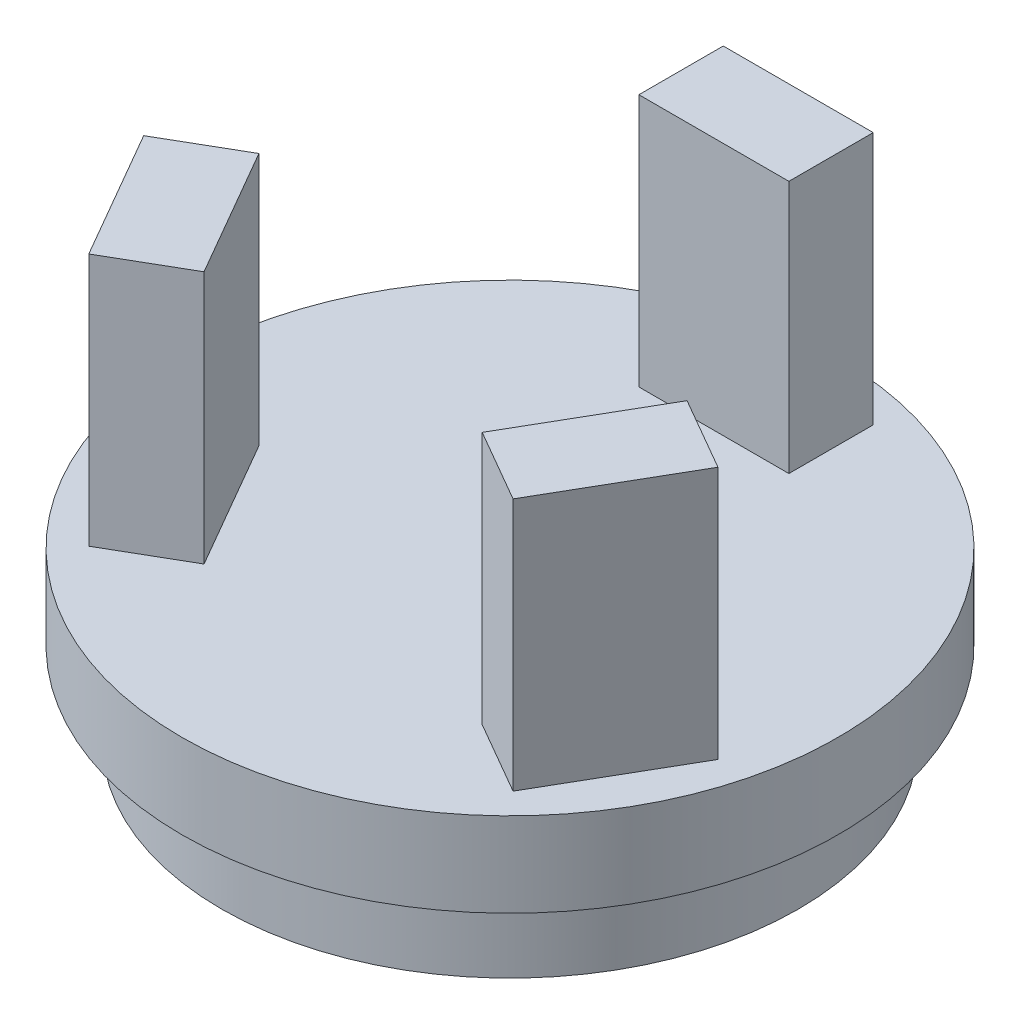
from build123d import *

# Parameters (mm, degrees)
ESQUISSE2_R        = 61.5
BOSS_EXTRU_1_DEPTH = 18
ESQUISSE3_R        = 70
BOSS_EXTRU_2_DEPTH = 18
BOSS_EXTRU_3_DEPTH = 54


with BuildPart() as part:
    # Esquisse2 → Boss.-Extru.1 (new body)
    with BuildSketch(Plane(origin=(0, 0, 0), x_dir=(1, 0, 0), z_dir=(0, 1, 0))):
        with Locations(Location((50.887518325, 23.784383565, 0), (0, 0, 270))):
            Circle(ESQUISSE2_R)
    extrude(amount=BOSS_EXTRU_1_DEPTH)

    # Esquisse3 → Boss.-Extru.2 (add)
    with BuildSketch(Plane(origin=(0, 18, 0), x_dir=(1, 0, 0), z_dir=(0, 1, 0))):
        with Locations(Location((50.887518325, 23.784383565, 0), (0, 0, 270))):
            Circle(ESQUISSE3_R)
    extrude(amount=BOSS_EXTRU_2_DEPTH)

    # Esquisse4 → Boss.-Extru.3 (add)
    with BuildSketch(Plane(origin=(0, 36, 0), x_dir=(1, 0, 0), z_dir=(0, 1, 0))):
        with BuildLine():
            ThreePointArc((-2.373044008, -6.965616435), (2.122342369, -13.688374727), (7.460993068, -19.763141096))
            Line((7.460993068, -19.763141096), (21.215413261, -11.822022896))
            Line((21.215413261, -11.822022896), (13.215413261, 2.034383565))
            Line((13.215413261, 2.034383565), (5.215413261, 15.890790026))
            Line((5.215413261, 15.890790026), (-8.539006932, 7.949671825))
            ThreePointArc((-8.539006932, 7.949671825), (-5.947430283, 0.288881513), (-2.373044008, -6.965616435))
        make_face()
        with BuildLine():
            Line((66.887518325, 67.284383565), (66.887518325, 83.166619966))
            ThreePointArc((66.887518325, 83.166619966), (58.957290978, 84.752643909), (50.887518325, 85.284383565))
            ThreePointArc((50.887518325, 85.284383565), (42.817745673, 84.752643909), (34.887518325, 83.166619966))
            Line((34.887518325, 83.166619966), (34.887518325, 67.284383565))
            Line((34.887518325, 67.284383565), (50.887518325, 67.284383565))
            Line((50.887518325, 67.284383565), (66.887518325, 67.284383565))
        make_face()
        with BuildLine():
            ThreePointArc((94.314043582, -19.763141096), (99.652694281, -13.688374727), (104.148080658, -6.965616435))
            ThreePointArc((104.148080658, -6.965616435), (107.722466934, 0.288881513), (110.314043582, 7.949671825))
            Line((110.314043582, 7.949671825), (96.55962339, 15.890790026))
            Line((96.55962339, 15.890790026), (88.55962339, 2.034383565))
            Line((88.55962339, 2.034383565), (80.55962339, -11.822022896))
            Line((80.55962339, -11.822022896), (94.314043582, -19.763141096))
        make_face()
        with BuildLine():
            ThreePointArc((110.314043582, 7.949671825), (107.722466934, 0.288881513), (104.148080658, -6.965616435))
            Line((104.148080658, -6.965616435), (112.148080658, 6.890790026))
            Line((112.148080658, 6.890790026), (110.314043582, 7.949671825))
        make_face()
        with BuildLine():
            Line((96.148080658, -20.822022896), (104.148080658, -6.965616435))
            ThreePointArc((104.148080658, -6.965616435), (99.652694281, -13.688374727), (94.314043582, -19.763141096))
            Line((94.314043582, -19.763141096), (96.148080658, -20.822022896))
        make_face()
        with BuildLine():
            ThreePointArc((50.887518325, 85.284383565), (58.957290978, 84.752643909), (66.887518325, 83.166619966))
            Line((66.887518325, 83.166619966), (66.887518325, 85.284383565))
            Line((66.887518325, 85.284383565), (50.887518325, 85.284383565))
        make_face()
        with BuildLine():
            ThreePointArc((34.887518325, 83.166619966), (42.817745673, 84.752643909), (50.887518325, 85.284383565))
            Line((50.887518325, 85.284383565), (34.887518325, 85.284383565))
            Line((34.887518325, 85.284383565), (34.887518325, 83.166619966))
        make_face()
        with BuildLine():
            Line((5.626955992, -20.822022896), (7.460993068, -19.763141096))
            ThreePointArc((7.460993068, -19.763141096), (2.122342369, -13.688374727), (-2.373044008, -6.965616435))
            Line((-2.373044008, -6.965616435), (5.626955992, -20.822022896))
        make_face()
        with BuildLine():
            Line((-10.373044008, 6.890790026), (-2.373044008, -6.965616435))
            ThreePointArc((-2.373044008, -6.965616435), (-5.947430283, 0.288881513), (-8.539006932, 7.949671825))
            Line((-8.539006932, 7.949671825), (-10.373044008, 6.890790026))
        make_face()
    extrude(amount=BOSS_EXTRU_3_DEPTH)


solid = part.part
